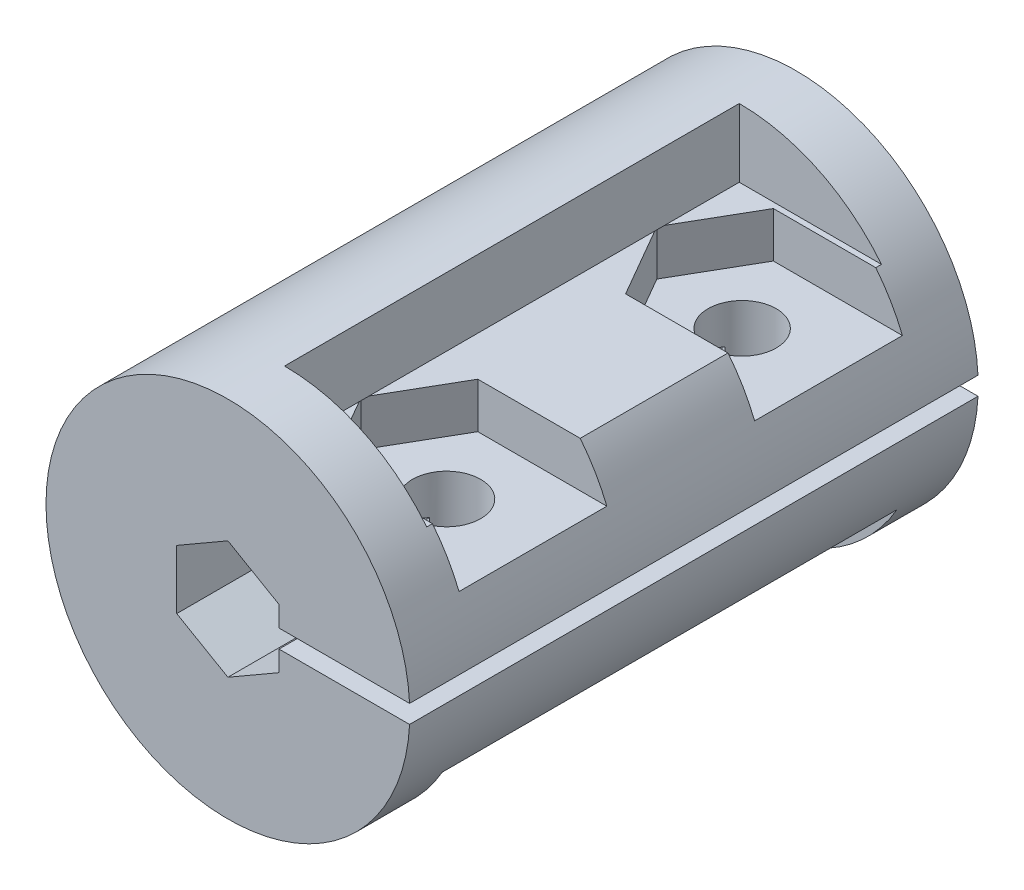
from build123d import *

# Parameters (mm, degrees)
RESSALTO_EXTRUS_O2_DEPTH = 25
ESBO_O3_W                = 7
ESBO_O3_H                = 20
CORTE_EXTRUS_O1_DEPTH    = 3
ESBO_O4_W                = 9.984895554
ESBO_O4_H                = 20
CORTE_EXTRUS_O2_DEPTH    = 4
ESBO_O5_R                = 1.5
CORTE_EXTRUS_O7_DEPTH    = 31.740852298
CORTE_EXTRUS_O8_DEPTH    = 3
CORTE_EXTRUS_O9_DEPTH    = 2
CORTE_EXTRUS_O11_DEPTH   = 3
RESSALTO_EXTRUS_O4_DEPTH = 7


with BuildPart() as part:
    # Esboço1 → Ressalto-extrusão2 (new body)
    with BuildSketch(Plane.XY):
        with BuildLine():
            Line((2.25, -0.4), (5.986651819, -0.4))
            Line((5.986651819, -0.4), (7.989993742, -0.4))
            ThreePointArc((7.989993742, -0.4), (-8, 0), (7.989993742, 0.4))
            Line((7.989993742, 0.4), (5.986651819, 0.4))
            Line((5.986651819, 0.4), (2.25, 0.4))
            Line((2.25, 0.4), (2.25, 1.299038106))
            Line((2.25, 1.299038106), (0, 2.598076211))
            Line((0, 2.598076211), (-2.25, 1.299038106))
            Line((-2.25, 1.299038106), (-2.25, -1.299038106))
            Line((-2.25, -1.299038106), (0, -2.598076211))
            Line((0, -2.598076211), (2.25, -1.299038106))
            Line((2.25, -1.299038106), (2.25, -0.4))
        make_face()
    extrude(amount=RESSALTO_EXTRUS_O2_DEPTH)

    # Esboço3 → Corte-extrusão1 (cut)
    with BuildSketch(Plane(origin=(0, 8, 0), x_dir=(1, 0, 0), z_dir=(0, 1, 0))):
        with Locations((4.489993742, -12.5)):
            Rectangle(ESBO_O3_W, ESBO_O3_H)
    extrude(amount=-CORTE_EXTRUS_O1_DEPTH, mode=Mode.SUBTRACT)

    # Esboço4 → Corte-extrusão2 (cut)
    with BuildSketch(Plane(origin=(0, -8, 0), x_dir=(1, 0, 0), z_dir=(0, 1, 0))):
        with Locations((5.982441519, -12.5)):
            Rectangle(ESBO_O4_W, ESBO_O4_H)
    extrude(amount=CORTE_EXTRUS_O2_DEPTH, mode=Mode.SUBTRACT)

    # Esboço5 → Corte-extrusão7 (cut, through all)
    with BuildSketch(Plane(origin=(0, -8, 0), x_dir=(1, 0, 0), z_dir=(0, 1, 0))):
        with Locations(Location((3.61749587, -6, 0), (0, 0, 155.736314367))):
            Circle(ESBO_O5_R)
        with Locations(Location((3.61749587, -19, 0), (0, 0, 155.736314367))):
            Circle(ESBO_O5_R)
    extrude(amount=CORTE_EXTRUS_O7_DEPTH, mode=Mode.SUBTRACT)

    # Esboço11 → Corte-extrusão8 (cut)
    with BuildSketch(Plane(origin=(0, 8, 0), x_dir=(1, 0, 0), z_dir=(0, 1, 0))):
        Polygon((0.989993742, -2.5), (0.489993742, -2.5), (0.489993742, -22.5), (0.989993742, -22.5), (12.059858903, -22.5), (12.059858903, -2.5), align=None)
    extrude(amount=-CORTE_EXTRUS_O8_DEPTH, mode=Mode.SUBTRACT)

    # Esboço12 → Corte-extrusão9 (cut)
    with BuildSketch(Plane(origin=(0, 5, 0), x_dir=(1, 0, 0), z_dir=(0, 1, 0))):
        Polygon((5.493884245, -9.25), (10.492692387, -9.25), (10.492692387, -2.75), (5.493884245, -2.75), (1.741107495, -2.75), (-0.135280879, -6), (1.741107495, -9.25), align=None)
        Polygon((5.493884245, -15.75), (1.741107495, -15.75), (-0.135280879, -19), (1.741107495, -22.25), (5.493884245, -22.25), (10.492692387, -22.25), (10.492692387, -15.75), align=None)
    extrude(amount=-CORTE_EXTRUS_O9_DEPTH, mode=Mode.SUBTRACT)

    # Esboço13 → Corte-extrusão11 (cut)
    with BuildSketch(Plane(origin=(0, 8, 0), x_dir=(1, 0, 0), z_dir=(0, 1, 0))):
        Polygon((0.489993742, -2.5), (-0.010006258, -2.5), (-0.010006258, -22.5), (0.489993742, -22.5), (15.48114744, -22.5), (15.48114744, -2.5), align=None)
    extrude(amount=-CORTE_EXTRUS_O11_DEPTH, mode=Mode.SUBTRACT)

    # Esboço14 → Ressalto-extrusão4 (add, symmetric)
    with BuildSketch(Plane.XY.offset(12.5)):
        Polygon((0, -2.598076211), (2.25, -1.299038106), (1.45, -1.299038106), (0, -2.136195996), (-1.85, -1.068097998), (-1.85, 1.068097998), (0, 2.136195996), (1.45, 1.299038106), (2.25, 1.299038106), (0, 2.598076211), (-2.25, 1.299038106), (-2.25, -1.299038106), align=None)
    extrude(amount=RESSALTO_EXTRUS_O4_DEPTH, both=True)


solid = part.part
